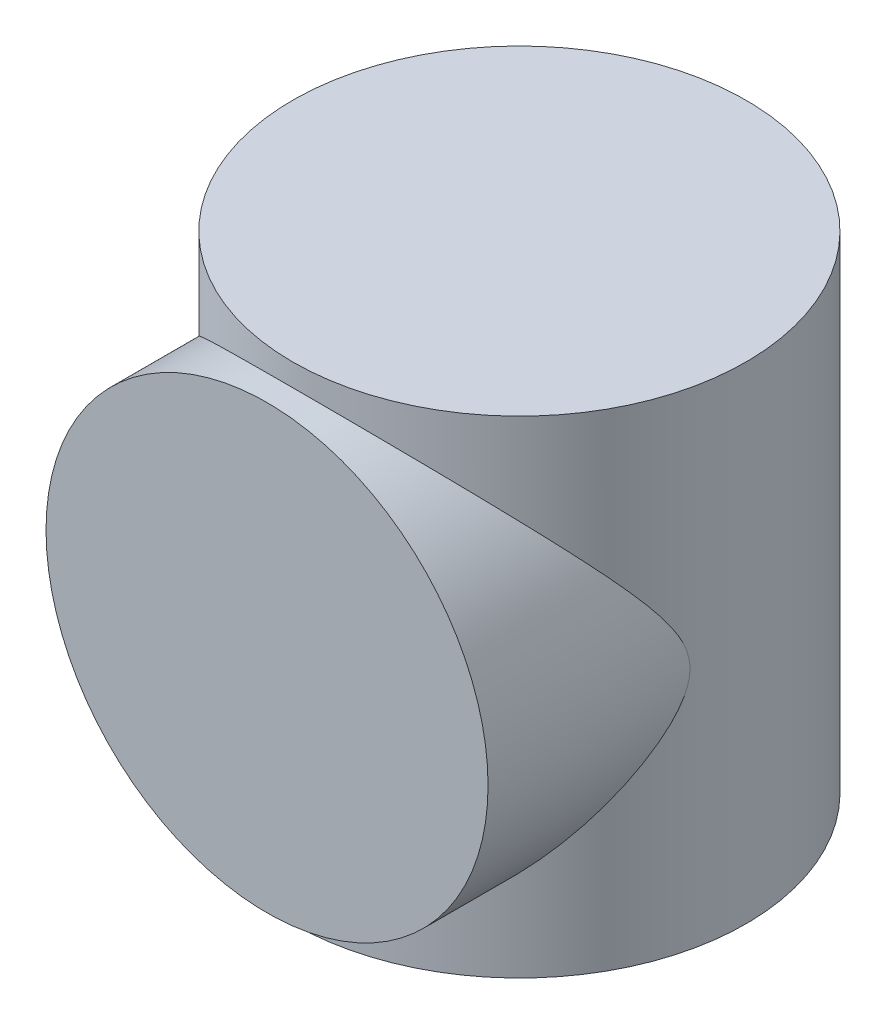
from build123d import *

# Parameters (mm, degrees)
SKETCH1_R           = 53.9
BOSS_EXTRUDE1_DEPTH = 115.7
SKETCH2_R           = 52.55
BOSS_EXTRUDE2_DEPTH = 60


with BuildPart() as part:
    # Sketch1 → Boss-Extrude1 (new body)
    with BuildSketch(Plane(origin=(0, 0, 0), x_dir=(1, 0, 0), z_dir=(0, 1, 0))):
        with Locations(Location((0, 0, 0), (0, 0, 270))):
            Circle(SKETCH1_R)
    extrude(amount=BOSS_EXTRUDE1_DEPTH)

    # Sketch2 → Boss-Extrude2 (add)
    with BuildSketch(Plane.XY):
        with Locations(Location((0, 57.85, 0), (0, 0, 180))):
            Circle(SKETCH2_R)
    extrude(amount=BOSS_EXTRUDE2_DEPTH)


solid = part.part
